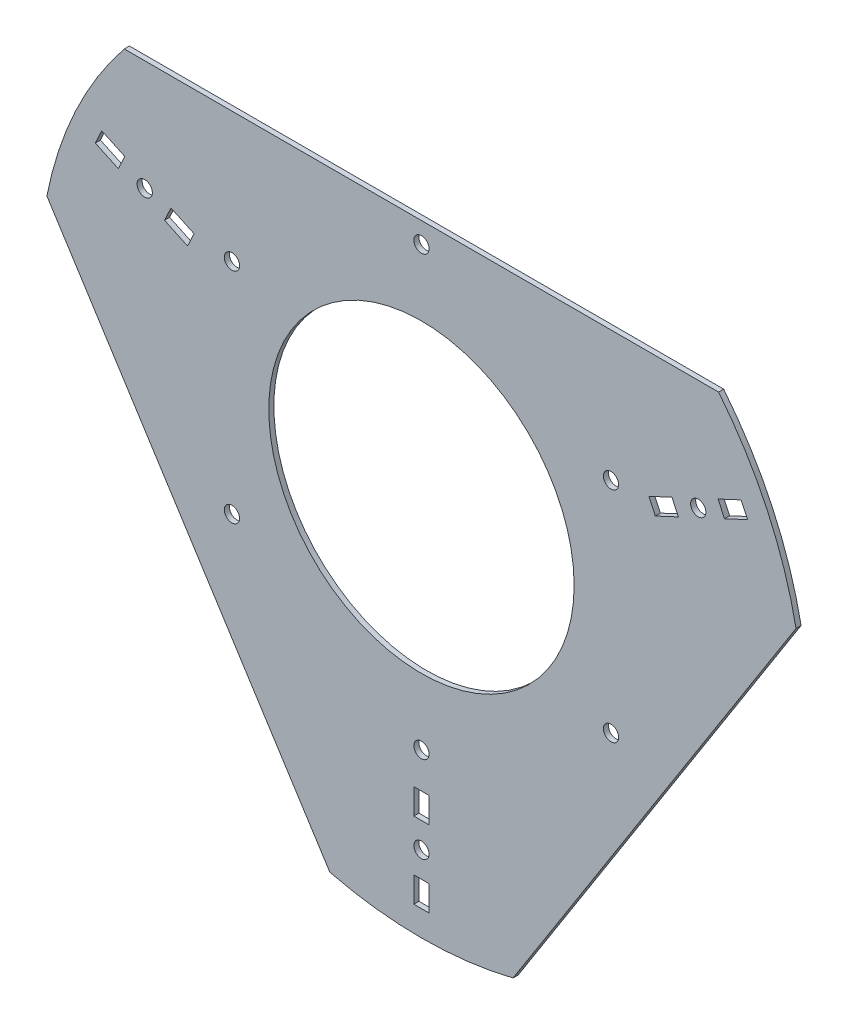
from build123d import *

# Parameters (mm, degrees)
SKETCH1_R           = 30
SKETCH1_R_2         = 1.5
SKETCH1_W           = 3
SKETCH1_H           = 5
BOSS_EXTRUDE1_DEPTH = 1


with BuildPart() as part:
    # Sketch1 → Boss-Extrude1 (new body)
    with BuildSketch(Plane.XY):
        with BuildLine():
            Line((-73.593555797, 14.456436117), (-18, -72.807966597))
            ThreePointArc((-18, -72.807966597), (0, -75), (18, -72.807966597))
            Line((18, -72.807966597), (73.593555797, 14.456436117))
            ThreePointArc((73.593555797, 14.456436117), (67.973084028, 31.696369631), (58.379298374, 47.083516451))
            Line((58.379298374, 47.083516451), (-58.379298374, 47.083516451))
            ThreePointArc((-58.379298374, 47.083516451), (-67.973084028, 31.696369631), (-73.593555797, 14.456436117))
        make_face()
        Circle(SKETCH1_R, mode=Mode.SUBTRACT)
        with Locations((0, -43)):
            Circle(SKETCH1_R_2, mode=Mode.SUBTRACT)
        with Locations((-37.239092363, -21.5)):
            Circle(SKETCH1_R_2, mode=Mode.SUBTRACT)
        with Locations((-37.239092363, 21.5)):
            Circle(SKETCH1_R_2, mode=Mode.SUBTRACT)
        with Locations((0, 43)):
            Circle(SKETCH1_R_2, mode=Mode.SUBTRACT)
        with Locations((37.239092363, 21.5)):
            Circle(SKETCH1_R_2, mode=Mode.SUBTRACT)
        with Locations((37.239092363, -21.5)):
            Circle(SKETCH1_R_2, mode=Mode.SUBTRACT)
        with Locations((0, -60)):
            Circle(SKETCH1_R_2, mode=Mode.SUBTRACT)
        with Locations((54.378467222, 25.357095704)):
            Circle(SKETCH1_R_2, mode=Mode.SUBTRACT)
        with Locations((-54.378467222, 25.357095704)):
            Circle(SKETCH1_R_2, mode=Mode.SUBTRACT)
        with Locations((0, -52.5)):
            Rectangle(SKETCH1_W, SKETCH1_H, mode=Mode.SUBTRACT)
        with Locations((0, -67.5)):
            Rectangle(SKETCH1_W, SKETCH1_H, mode=Mode.SUBTRACT)
        Polygon((49.213000894, 24.603466076), (44.681461959, 22.490374768), (45.949316744, 19.771451406), (50.48085568, 21.884542715), align=None, mode=Mode.SUBTRACT)
        Polygon((58.276078765, 28.829648694), (62.8076177, 30.942740002), (64.075472485, 28.223816641), (59.54393355, 26.110725333), align=None, mode=Mode.SUBTRACT)
        Polygon((-58.276078765, 28.829648694), (-62.8076177, 30.942740002), (-64.075472485, 28.223816641), (-59.54393355, 26.110725333), align=None, mode=Mode.SUBTRACT)
        Polygon((-49.213000894, 24.603466076), (-44.681461959, 22.490374768), (-45.949316744, 19.771451406), (-50.48085568, 21.884542715), align=None, mode=Mode.SUBTRACT)
    extrude(amount=BOSS_EXTRUDE1_DEPTH)


solid = part.part
